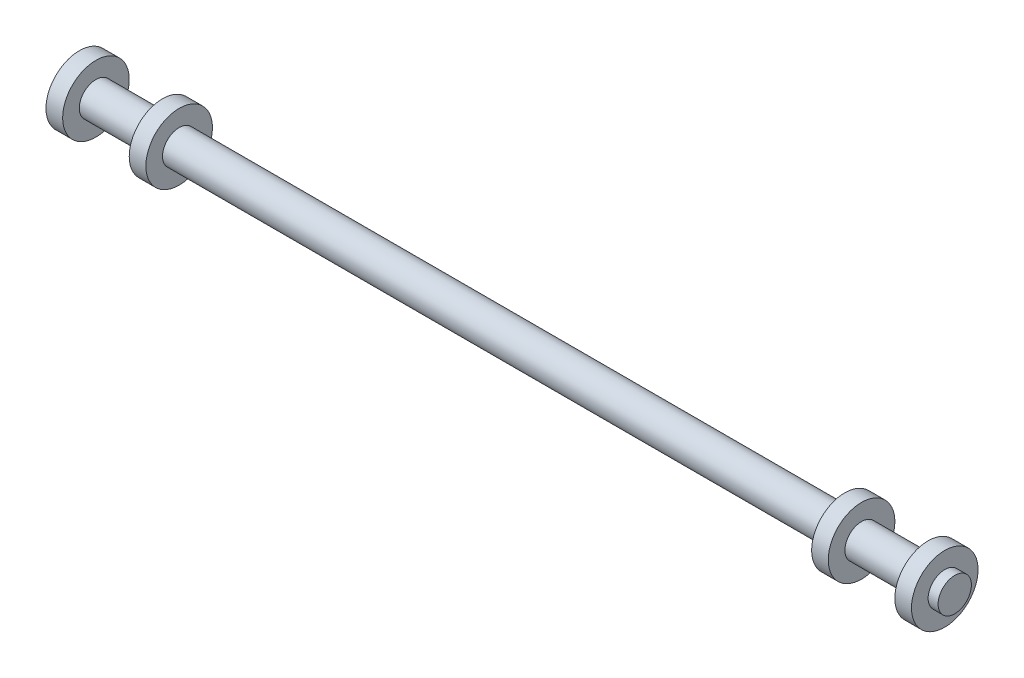
from build123d import *


with BuildPart() as part:
    # Sketch2 → Revolve1 (revolve)
    with BuildSketch(Plane.XY, mode=Mode.PRIVATE) as revolve1_sk:
        Polygon((50, 2.5), (-50, 2.5), (-50, 5), (-52.5, 5), (-52.5, 2.5), (-62.5, 2.5), (-62.5, 5), (-65, 5), (-65, 2.5), (-66.5, 2.5), (-66.5, 0), (66.5, 0), (66.5, 2.5), (65, 2.5), (65, 5), (62.5, 5), (62.5, 2.5), (52.5, 2.5), (52.5, 5), (50, 5), align=None)
    revolve(revolve1_sk.sketch.rotate(Axis((-66.5, 0, 0), (1, 0, 0)), 90), axis=Axis((-66.5, 0, 0), (1, 0, 0)))


solid = part.part
